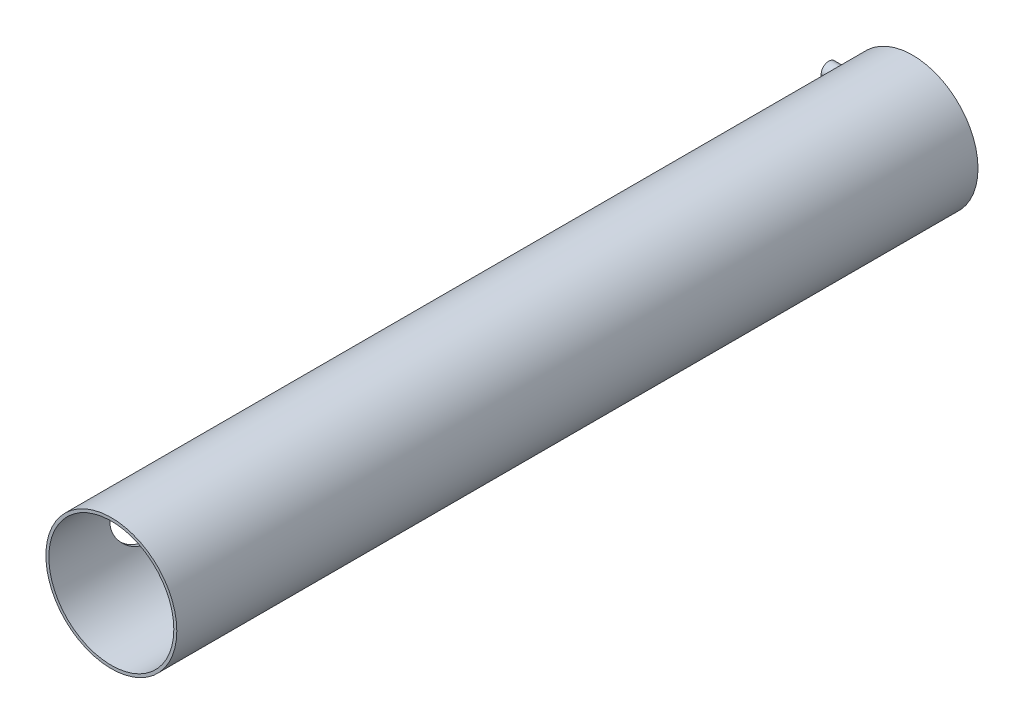
from build123d import *

# Parameters (mm, degrees)
SKETCH2_R           = 10.3759
BOSS_EXTRUDE1_DEPTH = 127
SKETCH3_R           = 9.906
CUT_EXTRUDE1_DEPTH  = 124.46
CUT_EXTRUDE2_DEPTH  = 12.7
BOSS_EXTRUDE2_DEPTH = 11.43


with BuildPart() as part:
    # Sketch2 → Boss-Extrude1 (new body)
    with BuildSketch(Plane.XY):
        Circle(SKETCH2_R)
    extrude(amount=BOSS_EXTRUDE1_DEPTH)

    # Sketch3 → Cut-Extrude1 (cut)
    with BuildSketch(Plane.XY.offset(127)):
        Circle(SKETCH3_R)
    extrude(amount=-CUT_EXTRUDE1_DEPTH, mode=Mode.SUBTRACT)

    # Sketch4 → Cut-Extrude2 (cut)
    with BuildSketch(Plane(origin=(0, 0, 0), x_dir=(0, 0, -1), z_dir=(1, 0, 0))):
        with BuildLine():
            Line((-112.627725765, 4.69603261), (-13.529396587, 4.69603261))
            ThreePointArc((-13.529396587, 4.69603261), (-8.833363977, 0), (-13.529396587, -4.69603261))
            Line((-13.529396587, -4.69603261), (-112.627725765, -4.69603261))
            ThreePointArc((-112.627725765, -4.69603261), (-117.323758375, 0), (-112.627725765, 4.69603261))
        make_face()
    extrude(amount=-CUT_EXTRUDE2_DEPTH, mode=Mode.SUBTRACT)

    # Sketch5 → Boss-Extrude2 (add)
    with BuildSketch(Plane(origin=(0, 0, 0), x_dir=(0, 0, -1), z_dir=(1, 0, 0))):
        with BuildLine():
            Line((-0.645409683, 3.552127231), (-0.645409683, -3.552127231))
            ThreePointArc((-0.645409683, -3.552127231), (-1.849520609, -4.756238156), (-3.053631534, -3.552127231))
            Line((-3.053631534, -3.552127231), (-3.053631534, 3.552127231))
            ThreePointArc((-3.053631534, 3.552127231), (-1.849520609, 4.756238156), (-0.645409683, 3.552127231))
        make_face()
    extrude(amount=-BOSS_EXTRUDE2_DEPTH)


solid = part.part
